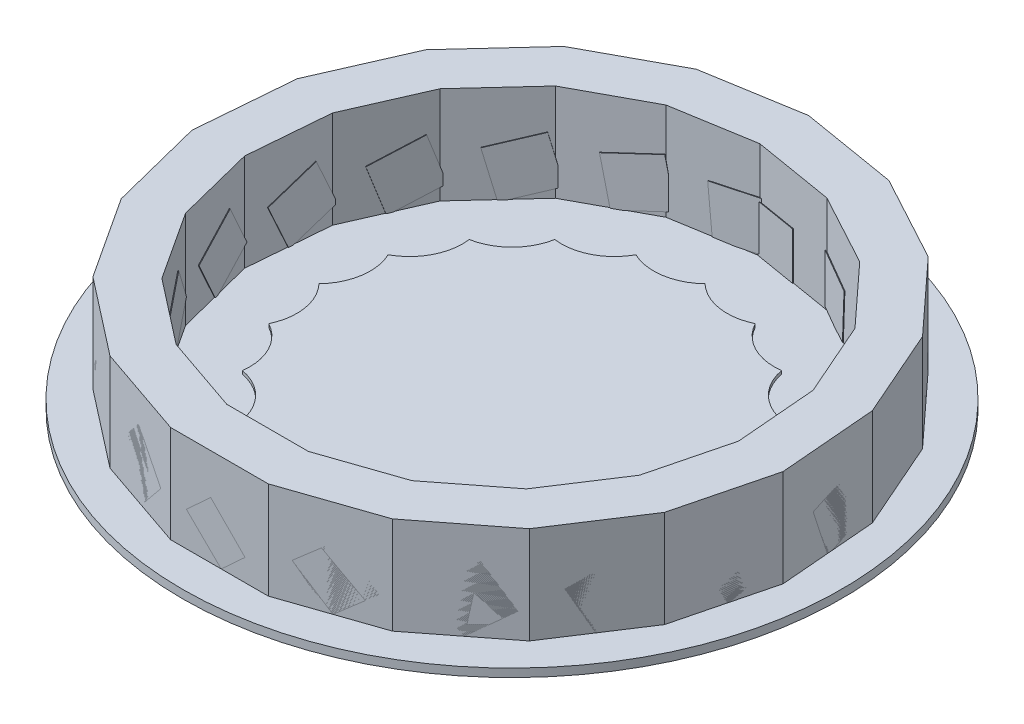
from build123d import *

# Parameters (mm, degrees)
SKETCH1_R            = 100
SKETCH1_R_2          = 2
DISK_BASE_DEPTH      = 2
OUTLINE_DEPTH        = 30
SKETCH7_W            = 14.813513125
SKETCH7_H            = 14.81
FIRST_PIECE_DEPTH    = 14.81
BOSS_EXTRUDE4_DEPTH  = 14.81
BOSS_EXTRUDE5_DEPTH  = 14.81
BOSS_EXTRUDE6_DEPTH  = 14.81
BOSS_EXTRUDE8_DEPTH  = 14.81
BOSS_EXTRUDE9_DEPTH  = 14.81
BOSS_EXTRUDE10_DEPTH = 14.81
BOSS_EXTRUDE11_DEPTH = 14.81
BOSS_EXTRUDE12_DEPTH = 14.81
BOSS_EXTRUDE13_DEPTH = 14.81
EXTRUDE_10_1_DEPTH   = 14.81
BOSS_EXTRUDE15_DEPTH = 14.81
BOSS_EXTRUDE16_DEPTH = 14.81
BOSS_EXTRUDE17_DEPTH = 14.81
BOSS_EXTRUDE18_DEPTH = 14.81
BOSS_EXTRUDE19_DEPTH = 14.81
BOSS_EXTRUDE20_DEPTH = 14.81
BOSS_EXTRUDE21_DEPTH = 14.81
BOSS_EXTRUDE22_DEPTH = 14.81
SKETCH27_R           = 100
SKETCH27_R_2         = 2
BOSS_EXTRUDE23_DEPTH = 0.5
BOSS_EXTRUDE24_DEPTH = 1


with BuildPart() as part:
    # Sketch1 → Disk Base (new body)
    with BuildSketch(Plane(origin=(0, 0, 0), x_dir=(1, 0, 0), z_dir=(0, 1, 0))):
        with Locations(Location((0, 0, 0), (0, 0, 270))):
            Circle(SKETCH1_R)
        with Locations(Location((0, 0, 0), (0, 0, 270))):
            Circle(SKETCH1_R_2, mode=Mode.SUBTRACT)
    extrude(amount=DISK_BASE_DEPTH)



with BuildPart() as body_2:
    # Sketch2 → Outline (new body)
    with BuildSketch(Plane(origin=(0, 2, 0), x_dir=(1, 0, 0), z_dir=(0, 1, 0))):
        Polygon((0, 90), (-29.222952228, 85.123551753), (-55.279144142, 71.022645846), (-75.344983044, 49.225334231), (-87.246023935, 22.093693843), (-89.692604371, -7.432141093), (-82.419599399, -36.152588219), (-66.215151961, -60.955341446), (-42.835265373, -79.152637609), (-14.813513125, -88.772517306), (14.813513125, -88.772517306), (42.835265373, -79.152637609), (66.215151961, -60.955341446), (82.419599399, -36.152588219), (89.692604371, -7.432141093), (87.246023935, 22.093693843), (75.344983044, 49.225334231), (55.279144142, 71.022645846), (29.222952228, 85.123551753), align=None)
        Polygon((0, 75.19), (-24.41415309, 71.115998403), (-46.182653867, 59.335474902), (-62.946547501, 41.125032009), (-72.889205996, 18.458053778), (-74.933188029, -6.209140986), (-68.856996431, -30.20347898), (-55.319080844, -50.924801371), (-35.786484482, -66.127631353), (-12.375867243, -74.164506403), (12.375867243, -74.164506403), (35.786484482, -66.127631353), (55.319080844, -50.924801371), (68.856996431, -30.20347898), (74.933188029, -6.209140986), (72.889205996, 18.458053778), (62.946547501, 41.125032009), (46.182653867, 59.335474902), (24.41415309, 71.115998403), align=None, mode=Mode.SUBTRACT)
    extrude(amount=OUTLINE_DEPTH)


with BuildPart() as body_3:
    # Sketch7 → First Piece (new body)
    with BuildSketch(Plane(origin=(14.611476114, 0, -87.561775877), x_dir=(-0.9863613034027225, 0, -0.1645945902807334), z_dir=(0.1645945902807334, 0, -0.9863613034027225))):
        with Locations((7.406756563, 9.405)):
            Rectangle(SKETCH7_W, SKETCH7_H)
    extrude(amount=-FIRST_PIECE_DEPTH)


with BuildPart() as body_4:
    # Sketch8 → Boss-Extrude4 (new body)
    with BuildSketch(Plane(origin=(42.251048185, 0, -78.073098799), x_dir=(-0.8794737512064892, 0, -0.47594739303707345), z_dir=(0.47594739303707345, 0, -0.8794737512064892))):
        Polygon((0, 2), (-1.223000106, 16.759416341), (13.536416235, 17.982416448), (14.759416341, 3.223000106), align=None)
    extrude(amount=-BOSS_EXTRUDE4_DEPTH)


with BuildPart() as body_5:
    # Sketch9 → Boss-Extrude5 (new body)
    with BuildSketch(Plane(origin=(65.312063593, 0, -60.123990038), x_dir=(-0.6772815716257411, 0, -0.7357239106731316), z_dir=(0.7357239106731316, 0, -0.6772815716257411))):
        Polygon((0, 2), (-2.437645882, 16.608010903), (12.170365021, 19.045656785), (14.608010903, 4.437645882), align=None)
    extrude(amount=-BOSS_EXTRUDE5_DEPTH)


with BuildPart() as body_6:
    # Sketch10 → Boss-Extrude6 (new body)
    with BuildSketch(Plane(origin=(81.295503489, 0, -35.659514037), x_dir=(-0.4016954246529702, 0, -0.9157733266550572), z_dir=(0.9157733266550572, 0, -0.4016954246529702))):
        Polygon((0, 2), (-3.635640065, 16.356817939), (10.721177874, 19.992458003), (14.356817939, 5.635640065), align=None)
    extrude(amount=-BOSS_EXTRUDE6_DEPTH)


with BuildPart() as body_7:
    # Sketch11 → Boss-Extrude8 (new body)
    with BuildSketch(Plane(origin=(88.469314153, 0, -7.330776375), x_dir=(-0.08257934547233159, 0, -0.99658449300667), z_dir=(0.9965844930066701, 0, -0.0825793454723316))):
        Polygon((0, 2), (-4.808799139, 16.00755335), (9.198754211, 20.816352489), (14.00755335, 6.808799139), align=None)
    extrude(amount=-BOSS_EXTRUDE8_DEPTH)


with BuildPart() as body_8:
    # Sketch12 → Boss-Extrude9 (new body)
    with BuildSketch(Plane(origin=(86.056101885, 0, 21.792364656), x_dir=(0.24548548714080035, 0, -0.9694002659393302), z_dir=(0.9694002659393302, 0, 0.24548548714080035))):
        Polygon((0, 2), (-5.949109239, 15.562602968), (7.613493729, 21.511712207), (13.562602968, 7.949109239), align=None)
    extrude(amount=-BOSS_EXTRUDE9_DEPTH)


with BuildPart() as body_9:
    # Sketch13 → Boss-Extrude10 (new body)
    with BuildSketch(Plane(origin=(74.31737568, 0, 48.553964833), x_dir=(0.5469481581224273, 0, -0.8371664782625284), z_dir=(0.8371664782625283, 0, 0.5469481581224271))):
        Polygon((0, 2), (-7.048780891, 15.025006255), (5.976225364, 22.073787146), (13.025006255, 9.048780891), align=None)
    extrude(amount=-BOSS_EXTRUDE10_DEPTH)


with BuildPart() as body_10:
    # Sketch14 → Boss-Extrude11 (new body)
    with BuildSketch(Plane(origin=(54.525208667, 0, 70.053989527), x_dir=(0.7891405093963944, 0, -0.6142127126896669), z_dir=(0.6142127126896669, 0, 0.7891405093963945))):
        Polygon((0, 2), (-8.100302222, 14.398435543), (4.298133321, 22.498737765), (12.398435543, 10.100302222), align=None)
    extrude(amount=-BOSS_EXTRUDE11_DEPTH)


with BuildPart() as body_11:
    # Sketch15 → Boss-Extrude12 (new body)
    with BuildSketch(Plane(origin=(28.824389249, 0, 83.962577457), x_dir=(0.9458172417006347, 0, -0.32469946920468323), z_dir=(0.32469946920468323, 0, 0.9458172417006347))):
        Polygon((0, 2), (-9.096490275, 13.687170944), (2.590680669, 22.783661219), (11.687170944, 11.096490275), align=None)
    extrude(amount=-BOSS_EXTRUDE12_DEPTH)


with BuildPart() as body_12:
    # Sketch16 → Boss-Extrude13 (new body)
    with BuildSketch(Plane.XY.offset(88.772517306)):
        Polygon((0, 2), (-10.030540076, 12.896071117), (0.865531041, 22.926611193), (10.896071117, 12.030540076), align=None)
    extrude(amount=-BOSS_EXTRUDE13_DEPTH)


with BuildPart() as body_13:
    # Sketch17 → Extrude 10-1 (new body)
    with BuildSketch(Plane(origin=(-28.824389249, 0, 83.962577457), x_dir=(0.9458172417006345, 0, 0.3246994692046841), z_dir=(-0.3246994692046841, 0, 0.9458172417006345))):
        Polygon((0, 2), (-10.896071117, 12.030540076), (-0.865531041, 22.926611193), (10.030540076, 12.896071117), align=None)
    extrude(amount=-EXTRUDE_10_1_DEPTH)


with BuildPart() as body_14:
    # Sketch18 → Boss-Extrude15 (new body)
    with BuildSketch(Plane(origin=(-54.525208667, 0, 70.053989527), x_dir=(0.789140509396393, 0, 0.6142127126896687), z_dir=(-0.6142127126896687, 0, 0.789140509396393))):
        Polygon((0, 2), (-11.687170944, 11.096490275), (-2.590680669, 22.783661219), (9.096490275, 13.687170944), align=None)
    extrude(amount=-BOSS_EXTRUDE15_DEPTH)


with BuildPart() as body_15:
    # Sketch19 → Boss-Extrude16 (new body)
    with BuildSketch(Plane(origin=(-74.31737568, 0, 48.553964833), x_dir=(0.5469481581224265, 0, 0.837166478262529), z_dir=(-0.837166478262529, 0, 0.5469481581224265))):
        Polygon((0, 2), (-12.398435543, 10.100302222), (-4.298133321, 22.498737765), (8.100302222, 14.398435543), align=None)
    extrude(amount=-BOSS_EXTRUDE16_DEPTH)


with BuildPart() as body_16:
    # Sketch20 → Boss-Extrude17 (new body)
    with BuildSketch(Plane(origin=(-86.056101885, 0, 21.792364656), x_dir=(0.2454854871407987, 0, 0.9694002659393305), z_dir=(-0.9694002659393305, 0, 0.2454854871407987))):
        Polygon((0, 2), (-13.025006255, 9.048780891), (-5.976225364, 22.073787146), (7.048780891, 15.025006255), align=None)
    extrude(amount=-BOSS_EXTRUDE17_DEPTH)


with BuildPart() as body_17:
    # Sketch21 → Boss-Extrude18 (new body)
    with BuildSketch(Plane(origin=(-88.469314153, 0, -7.330776375), x_dir=(-0.08257934547233318, 0, 0.9965844930066698), z_dir=(-0.9965844930066698, 0, -0.08257934547233318))):
        Polygon((0, 2), (-13.562602968, 7.949109239), (-7.613493729, 21.511712207), (5.949109239, 15.562602968), align=None)
    extrude(amount=-BOSS_EXTRUDE18_DEPTH)


with BuildPart() as body_18:
    # Sketch22 → Boss-Extrude19 (new body)
    with BuildSketch(Plane(origin=(-81.295503489, 0, -35.659514037), x_dir=(-0.4016954246529699, 0, 0.9157733266550573), z_dir=(-0.9157733266550573, 0, -0.4016954246529699))):
        Polygon((0, 2), (-14.00755335, 6.808799139), (-9.198754211, 20.816352489), (4.808799139, 16.00755335), align=None)
    extrude(amount=-BOSS_EXTRUDE19_DEPTH)


with BuildPart() as body_19:
    # Sketch23 → Boss-Extrude20 (new body)
    with BuildSketch(Plane(origin=(-65.312063593, 0, -60.123990038), x_dir=(-0.6772815716257414, 0, 0.7357239106731314), z_dir=(-0.7357239106731314, 0, -0.6772815716257414))):
        Polygon((0, 2), (-14.356817939, 5.635640065), (-10.721177874, 19.992458003), (3.635640065, 16.356817939), align=None)
    extrude(amount=-BOSS_EXTRUDE20_DEPTH)


with BuildPart() as body_20:
    # Sketch25 → Boss-Extrude21 (new body)
    with BuildSketch(Plane(origin=(-42.251048185, 0, -78.073098799), x_dir=(-0.8794737512064893, 0, 0.4759473930370732), z_dir=(-0.4759473930370732, 0, -0.8794737512064893))):
        Polygon((0, 2), (-14.608010903, 4.437645882), (-12.170365021, 19.045656785), (2.437645882, 16.608010903), align=None)
    extrude(amount=-BOSS_EXTRUDE21_DEPTH)


with BuildPart() as body_21:
    # Sketch26 → Boss-Extrude22 (new body)
    with BuildSketch(Plane(origin=(-14.611476114, 0, -87.561775877), x_dir=(-0.9863613034027225, 0, 0.1645945902807335), z_dir=(-0.1645945902807335, 0, -0.9863613034027225))):
        Polygon((0, 2), (-14.759416341, 3.223000106), (-13.536416235, 17.982416448), (1.223000106, 16.759416341), align=None)
    extrude(amount=-BOSS_EXTRUDE22_DEPTH)


with BuildPart() as part_1:
    add(part.part)

    add(body_3.part)  # Boss-Extrude23 merges body 3

    add(body_4.part)  # Boss-Extrude23 merges body 4

    add(body_5.part)  # Boss-Extrude23 merges body 5

    add(body_6.part)  # Boss-Extrude23 merges body 6

    add(body_7.part)  # Boss-Extrude23 merges body 7

    add(body_8.part)  # Boss-Extrude23 merges body 8

    add(body_9.part)  # Boss-Extrude23 merges body 9

    add(body_10.part)  # Boss-Extrude23 merges body 10

    add(body_11.part)  # Boss-Extrude23 merges body 11

    add(body_12.part)  # Boss-Extrude23 merges body 12

    add(body_13.part)  # Boss-Extrude23 merges body 13

    add(body_14.part)  # Boss-Extrude23 merges body 14

    add(body_15.part)  # Boss-Extrude23 merges body 15

    add(body_16.part)  # Boss-Extrude23 merges body 16

    add(body_17.part)  # Boss-Extrude23 merges body 17

    add(body_18.part)  # Boss-Extrude23 merges body 18

    add(body_19.part)  # Boss-Extrude23 merges body 19

    add(body_20.part)  # Boss-Extrude23 merges body 20

    add(body_21.part)  # Boss-Extrude23 merges body 21
    # Sketch27 → Boss-Extrude23 (add)
    with BuildSketch(Plane(origin=(0, 2, 0), x_dir=(1, 0, 0), z_dir=(0, 1, 0))):
        with Locations(Location((0, 0, 0), (0, 0, 270))):
            Circle(SKETCH27_R)
        with Locations(Location((0, 0, 0), (0, 0, 270))):
            Circle(SKETCH27_R_2, mode=Mode.SUBTRACT)
    extrude(amount=BOSS_EXTRUDE23_DEPTH)

    # Sketch28 → Boss-Extrude24 (add)
    with BuildSketch(Plane(origin=(0, 2.5, 0), x_dir=(1, 0, 0), z_dir=(0, 1, 0))):
        with BuildLine():
            ThreePointArc((0, 58.570323567), (-8.603895577, 54.322858733), (-18.099225348, 55.70368789))
            ThreePointArc((-18.099225348, 55.70368789), (-24.969477486, 49.00535883), (-34.426772415, 47.384387132))
            ThreePointArc((-34.426772415, 47.384387132), (-38.890872965, 38.890872965), (-47.384387132, 34.426772415))
            ThreePointArc((-47.384387132, 34.426772415), (-49.00535883, 24.969477486), (-55.70368789, 18.099225348))
            ThreePointArc((-55.70368789, 18.099225348), (-54.322858733, 8.603895577), (-58.570323567, 0))
            ThreePointArc((-58.570323567, 0), (-54.322858733, -8.603895577), (-55.70368789, -18.099225348))
            ThreePointArc((-55.70368789, -18.099225348), (-49.00535883, -24.969477486), (-47.384387132, -34.426772415))
            ThreePointArc((-47.384387132, -34.426772415), (-38.890872965, -38.890872965), (-34.426772415, -47.384387132))
            ThreePointArc((-34.426772415, -47.384387132), (-24.969477486, -49.00535883), (-18.099225348, -55.70368789))
            ThreePointArc((-18.099225348, -55.70368789), (-8.603895577, -54.322858733), (0, -58.570323567))
            ThreePointArc((0, -58.570323567), (8.603895577, -54.322858733), (18.099225348, -55.70368789))
            ThreePointArc((18.099225348, -55.70368789), (24.969477486, -49.00535883), (34.426772415, -47.384387132))
            ThreePointArc((34.426772415, -47.384387132), (38.890872965, -38.890872965), (47.384387132, -34.426772415))
            ThreePointArc((47.384387132, -34.426772415), (49.00535883, -24.969477486), (55.70368789, -18.099225348))
            ThreePointArc((55.70368789, -18.099225348), (54.322858733, -8.603895577), (58.570323567, 0))
            ThreePointArc((58.570323567, 0), (54.322858733, 8.603895577), (55.70368789, 18.099225348))
            ThreePointArc((55.70368789, 18.099225348), (49.00535883, 24.969477486), (47.384387132, 34.426772415))
            ThreePointArc((47.384387132, 34.426772415), (38.890872965, 38.890872965), (34.426772415, 47.384387132))
            ThreePointArc((34.426772415, 47.384387132), (24.969477486, 49.00535883), (18.099225348, 55.70368789))
            ThreePointArc((18.099225348, 55.70368789), (8.603895577, 54.322858733), (0, 58.570323567))
        make_face()
    extrude(amount=BOSS_EXTRUDE24_DEPTH)


solid = Compound([body_2.part, part_1.part])
